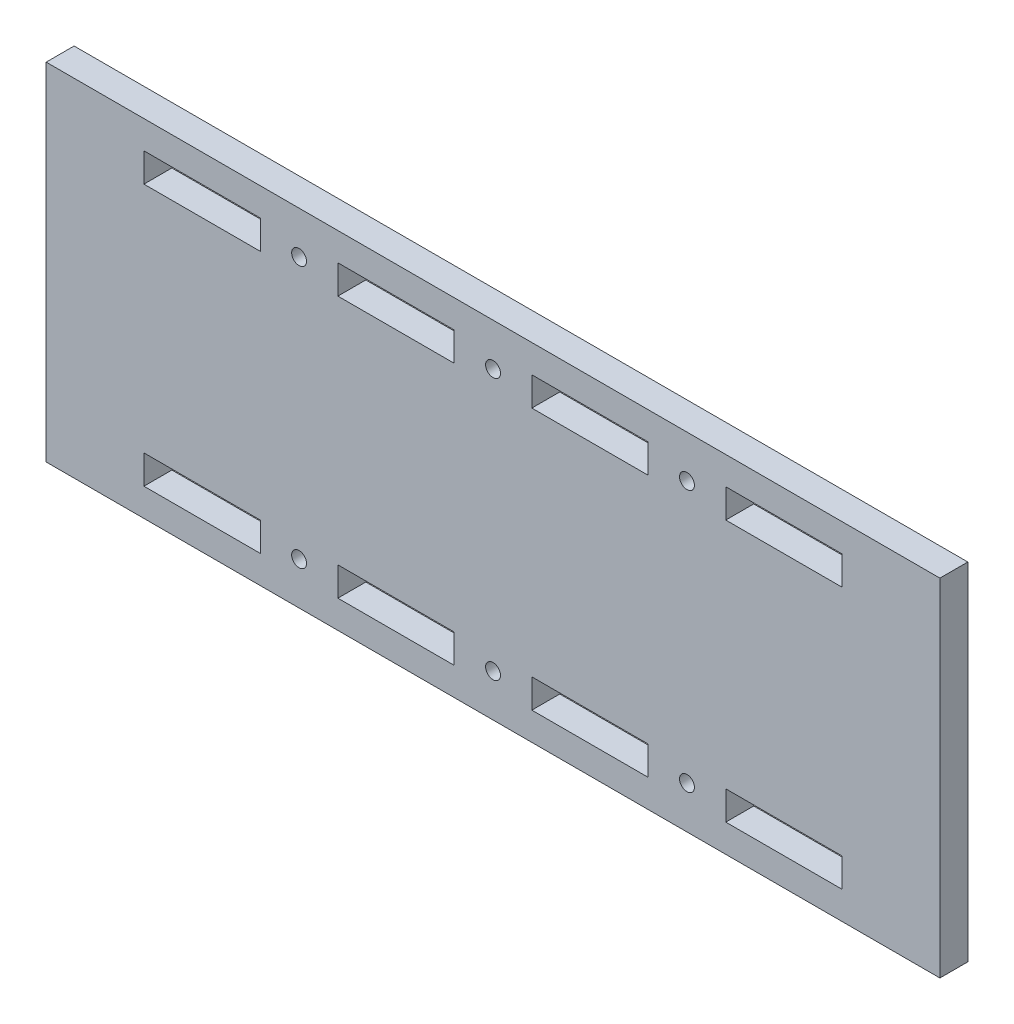
from build123d import *

# Parameters (mm, degrees)
SKETCH1_W           = 192
SKETCH1_H           = 74.4
SKETCH1_R           = 1.6
SKETCH1_W_2         = 25
SKETCH1_H_2         = 6.2
BOSS_EXTRUDE1_DEPTH = 6


with BuildPart() as part:
    # Sketch1 → Boss-Extrude1 (new body)
    with BuildSketch(Plane.XY):
        Rectangle(SKETCH1_W, SKETCH1_H)
        with Locations((-41.666666667, -28.1)):
            Circle(SKETCH1_R, mode=Mode.SUBTRACT)
        with Locations((0, -28.1)):
            Circle(SKETCH1_R, mode=Mode.SUBTRACT)
        with Locations((41.666666667, -28.1)):
            Circle(SKETCH1_R, mode=Mode.SUBTRACT)
        with Locations((0, 28.1)):
            Circle(SKETCH1_R, mode=Mode.SUBTRACT)
        with Locations((41.666666667, 28.1)):
            Circle(SKETCH1_R, mode=Mode.SUBTRACT)
        with Locations((-41.666666667, 28.1)):
            Circle(SKETCH1_R, mode=Mode.SUBTRACT)
        with Locations((-20.833333333, -28.1)):
            Rectangle(SKETCH1_W_2, SKETCH1_H_2, mode=Mode.SUBTRACT)
        with Locations((-62.5, -28.1)):
            Rectangle(SKETCH1_W_2, SKETCH1_H_2, mode=Mode.SUBTRACT)
        with Locations((20.833333333, -28.1)):
            Rectangle(SKETCH1_W_2, SKETCH1_H_2, mode=Mode.SUBTRACT)
        with Locations((62.5, -28.1)):
            Rectangle(SKETCH1_W_2, SKETCH1_H_2, mode=Mode.SUBTRACT)
        with Locations((-62.5, 28.1)):
            Rectangle(SKETCH1_W_2, SKETCH1_H_2, mode=Mode.SUBTRACT)
        with Locations((-20.833333333, 28.1)):
            Rectangle(SKETCH1_W_2, SKETCH1_H_2, mode=Mode.SUBTRACT)
        with Locations((20.833333333, 28.1)):
            Rectangle(SKETCH1_W_2, SKETCH1_H_2, mode=Mode.SUBTRACT)
        with Locations((62.5, 28.1)):
            Rectangle(SKETCH1_W_2, SKETCH1_H_2, mode=Mode.SUBTRACT)
    extrude(amount=BOSS_EXTRUDE1_DEPTH)


solid = part.part
